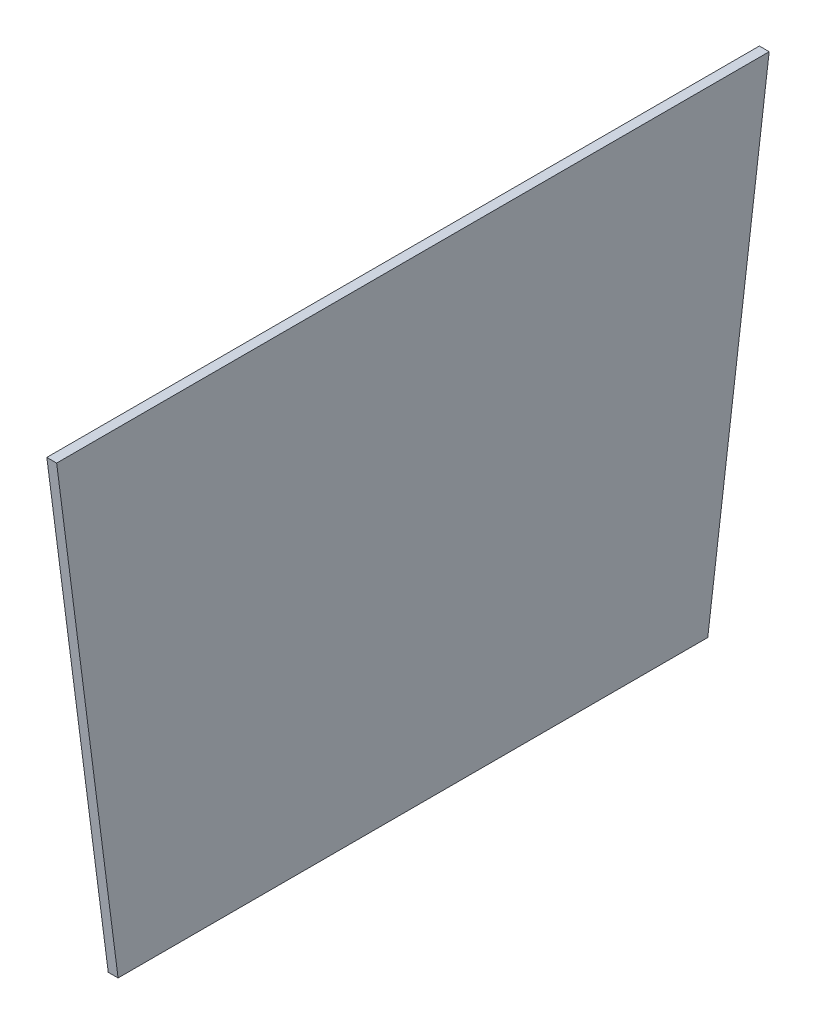
from build123d import *

# Parameters (mm, degrees)
BOSS_EXTRUDE1_DEPTH = 5.08


with BuildPart() as part:
    # Sketch1 → Boss-Extrude1 (new body)
    with BuildSketch(Plane(origin=(0, 0, 0), x_dir=(0, 0, -1), z_dir=(1, 0, 0))):
        Polygon((-184.15, 246.38), (184.15, 246.38), (152.4, 0), (-152.4, 0), align=None)
    extrude(amount=BOSS_EXTRUDE1_DEPTH)


solid = part.part
